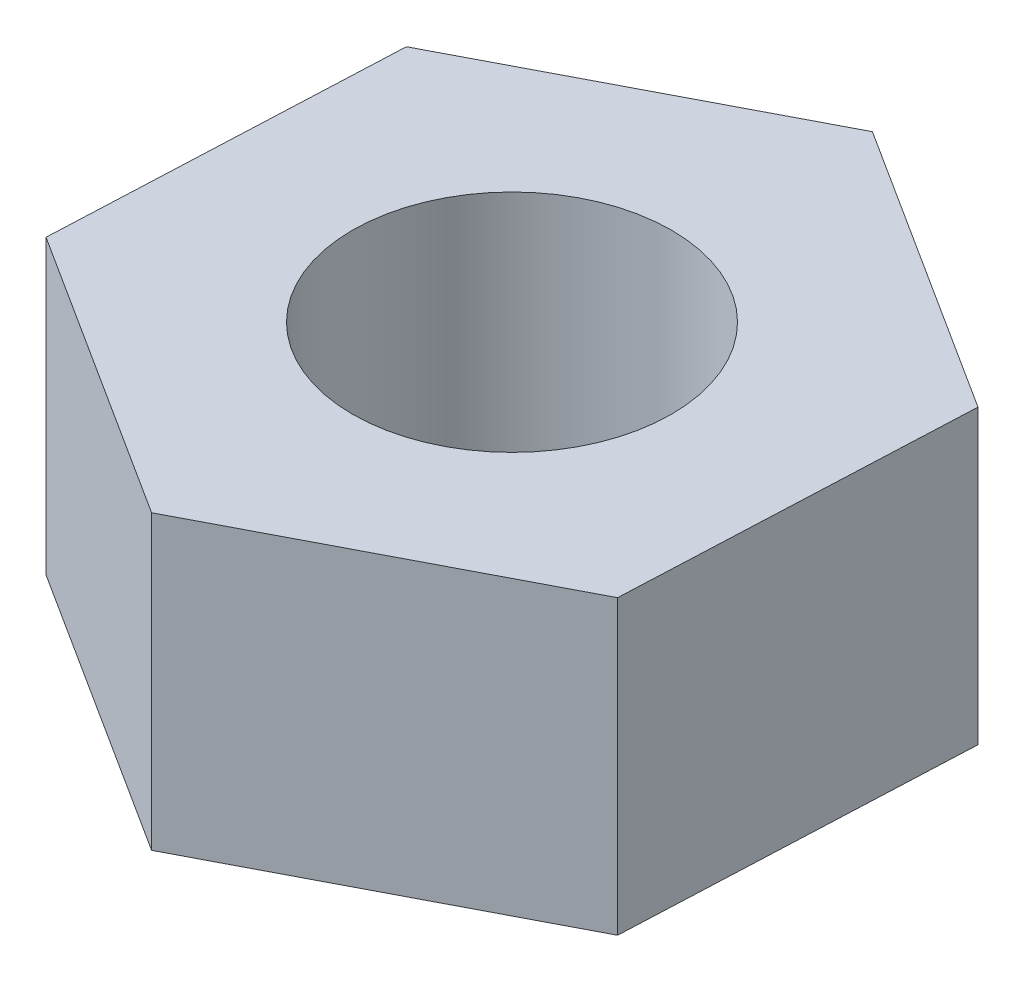
from build123d import *

# Parameters (mm, degrees)
BOSS_EXTRUDE1_DEPTH = 5.5
SKETCH2_R           = 3
CUT_EXTRUDE1_DEPTH  = 5.5


with BuildPart() as part:
    # Sketch1 → Boss-Extrude1 (new body)
    with BuildSketch(Plane(origin=(0, 0, 0), x_dir=(1, 0, 0), z_dir=(0, 1, 0))):
        Polygon((5.480812472, -3.494380438), (5.766628466, 2.999332615), (0.285815994, 6.493713053), (-5.480812472, 3.494380438), (-5.766628466, -2.999332615), (-0.285815994, -6.493713053), align=None)
    extrude(amount=BOSS_EXTRUDE1_DEPTH)

    # Sketch2 → Cut-Extrude1 (cut)
    with BuildSketch(Plane(origin=(0, 5.5, 0), x_dir=(1, 0, 0), z_dir=(0, 1, 0))):
        with Locations(Location((0, 0, 0), (0, 0, 270))):
            Circle(SKETCH2_R)
    extrude(amount=-CUT_EXTRUDE1_DEPTH, mode=Mode.SUBTRACT)


solid = part.part
